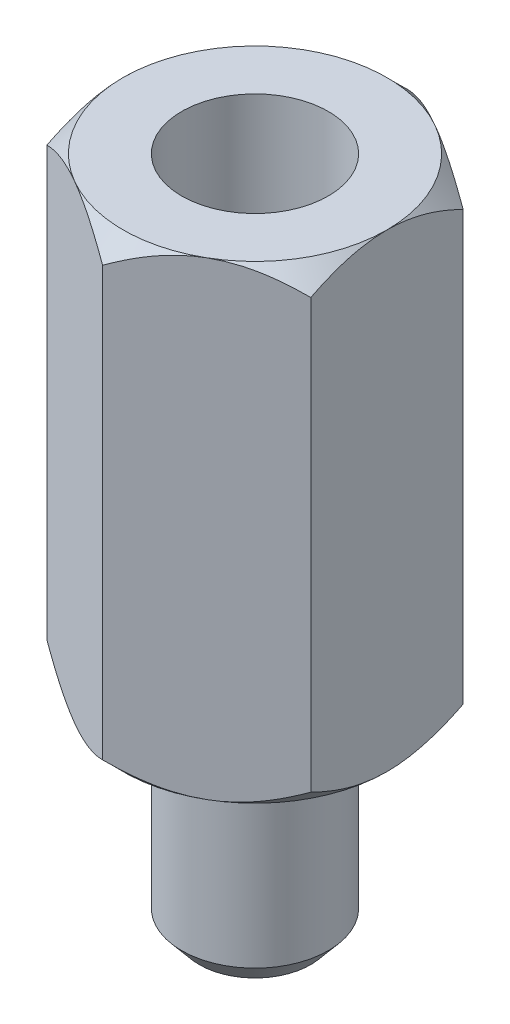
from build123d import *

# Parameters (mm, degrees)
SKETCH_1_R          = 1.25
EXTRUDE_1_DEPTH     = 3.5
EXTRUDE_2_DEPTH     = 8
CUT_EXTRUDE_START   = -4.8
SKETCH_3_R          = 1.25
CUT_EXTRUDE_1_DEPTH = 4.8
SKETCH_5_OUTSIDE_W  = 35.184
SKETCH_5_OUTSIDE_H  = 35.88
SKETCH_5_OUTSIDE_R  = 2.25
CUT_EXTRUDE_2_DEPTH = 13.002603884
CUT_EXTRUDE_2_DRAFT = -45
SKETCH_7_OUTSIDE_W  = 28.594
SKETCH_7_OUTSIDE_H  = 29.29
SKETCH_7_OUTSIDE_R  = 2.25
CUT_EXTRUDE_3_DEPTH = 9.707037384
CUT_EXTRUDE_3_DRAFT = -45
CHAMFER_1_SIZE      = 0.3
CHAMFER_1_SIZE2     = 0.357526078


with BuildPart() as part:
    # 草图1 → 凸台-拉伸1 (new body)
    with BuildSketch(Plane(origin=(0, 0, 0), x_dir=(1, 0, 0), z_dir=(0, 1, 0))):
        with Locations(Location((0, 0, 0), (0, 0, 270))):
            Circle(SKETCH_1_R)
    extrude(amount=EXTRUDE_1_DEPTH)

    # 草图2 → 凸台-拉伸2 (add)
    with BuildSketch(Plane(origin=(0, 3.5, 0), x_dir=(1, 0, 0), z_dir=(0, 1, 0))):
        Polygon((-2.25, 1.299038106), (-2.25, -1.299038106), (0, -2.598076211), (2.25, -1.299038106), (2.25, 1.299038106), (0, 2.598076211), align=None)
    extrude(amount=EXTRUDE_2_DEPTH)

    # 草图3 → 切除-拉伸1 (cut)
    with BuildSketch(Plane(origin=(0, 11.5, 0), x_dir=(1, 0, 0), z_dir=(0, 1, 0)).offset(CUT_EXTRUDE_START)):
        with Locations(Location((0, 0, 0), (0, 0, 270))):
            Circle(SKETCH_3_R)
    extrude(amount=CUT_EXTRUDE_1_DEPTH, mode=Mode.SUBTRACT)


with BuildPart() as cut_extrude_2_tool:
    # 草图5 outside → 切除-拉伸2 (with draft: the straight prism first)
    with BuildSketch(Plane(origin=(0, 11.5, 0), x_dir=(1, 0, 0), z_dir=(0, 1, 0))):
        Rectangle(SKETCH_5_OUTSIDE_W, SKETCH_5_OUTSIDE_H)
        Circle(SKETCH_5_OUTSIDE_R, mode=Mode.SUBTRACT)
    extrude(amount=-CUT_EXTRUDE_2_DEPTH)
    # 切除-拉伸2: the draft: its side faces are tilted about the plane it starts from
    cut_extrude_2_sides = [cut_extrude_2_tool.faces().sort_by_distance(p)[0] for p in [
        (0, 4.998698058, 17.94),
        (17.592, 4.998698058, 0),
        (0, 4.998698058, -17.94),
        (-17.592, 4.998698058, 0),
        (-2.25, 4.998698058, 0),
    ]]
    draft(cut_extrude_2_sides, Plane(origin=(0, 11.5, 0), x_dir=(1, 0, 0), z_dir=(0, 1, 0)), CUT_EXTRUDE_2_DRAFT)


with BuildPart() as part_1:
    add(part.part)

    # 切除-拉伸2: cut by cut_extrude_2_tool
    add(cut_extrude_2_tool.part, mode=Mode.SUBTRACT)


with BuildPart() as cut_extrude_3_tool:
    # 草图7 outside → 切除-拉伸3 (with draft: the straight prism first)
    with BuildSketch(Plane.XZ.offset(-3.5)):
        Rectangle(SKETCH_7_OUTSIDE_W, SKETCH_7_OUTSIDE_H)
        Circle(SKETCH_7_OUTSIDE_R, mode=Mode.SUBTRACT)
    extrude(amount=-CUT_EXTRUDE_3_DEPTH)
    # 切除-拉伸3: the draft: its side faces are tilted about the plane it starts from
    cut_extrude_3_sides = [cut_extrude_3_tool.faces().sort_by_distance(p)[0] for p in [
        (0, 8.353518692, -14.645),
        (14.297, 8.353518692, 0),
        (0, 8.353518692, 14.645),
        (-14.297, 8.353518692, 0),
        (-2.25, 8.353518692, 0),
    ]]
    draft(cut_extrude_3_sides, Plane.XZ.offset(-3.5), CUT_EXTRUDE_3_DRAFT)


with BuildPart() as part_2:
    add(part_1.part)

    # 切除-拉伸3: cut by cut_extrude_3_tool
    add(cut_extrude_3_tool.part, mode=Mode.SUBTRACT)

    # 倒角1
    chamfer_1_edges = [part_2.edges().sort_by_distance(p)[0] for p in [
        (0, 0, -1.25),
    ]]
    chamfer_1_side = [part_2.faces().sort_by_distance(p)[0] for p in [
        (0, 0, 0),
    ]]
    chamfer(chamfer_1_edges, length=CHAMFER_1_SIZE, length2=CHAMFER_1_SIZE2, reference=chamfer_1_side[0])


solid = part_2.part
